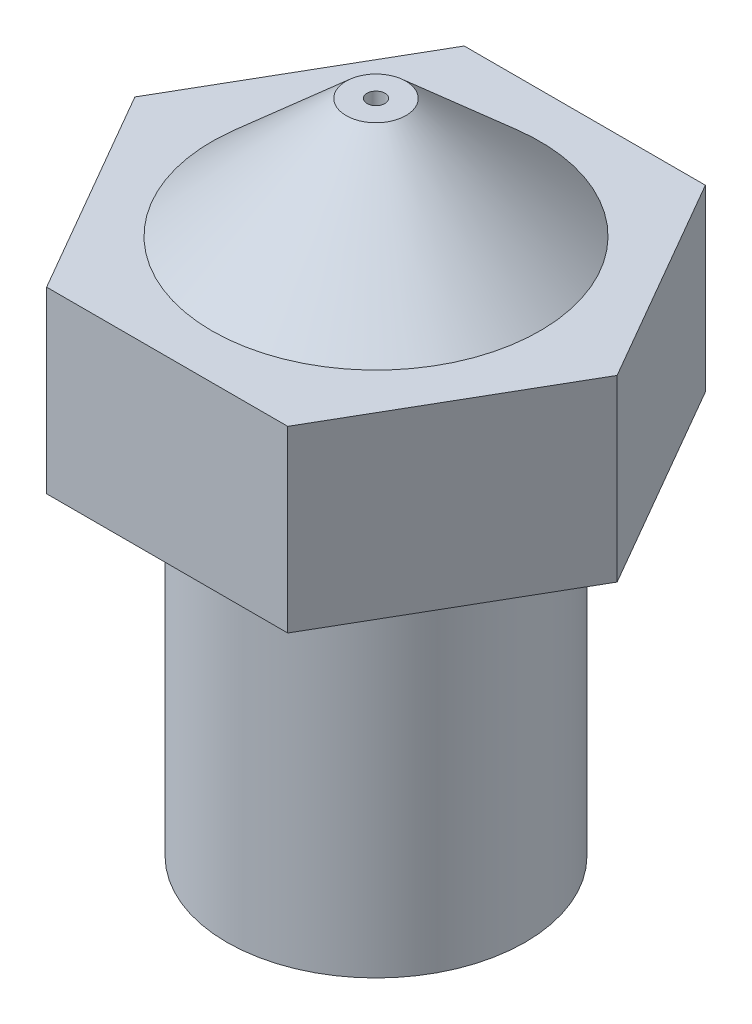
from build123d import *

# Parameters (mm, degrees)
BOSS_EXTRUDE1_DEPTH = 3
SKETCH2_R           = 2.75
BOSS_EXTRUDE2_DEPTH = 2
BOSS_EXTRUDE2_TAPER = 48.36
SKETCH4_R           = 0.15
CUT_EXTRUDE1_DEPTH  = 1.5
SKETCH6_R           = 2.5
BOSS_EXTRUDE3_DEPTH = 6
SKETCH7_R           = 1
CUT_EXTRUDE3_DEPTH  = 9.5


with BuildPart() as part:
    # Sketch1 → Boss-Extrude1 (new body)
    with BuildSketch(Plane(origin=(0, 0, 0), x_dir=(1, 0, 0), z_dir=(0, 1, 0))):
        Polygon((4.041451884, 0), (2.020725942, 3.5), (-2.020725942, 3.5), (-4.041451884, 0), (-2.020725942, -3.5), (2.020725942, -3.5), align=None)
    extrude(amount=BOSS_EXTRUDE1_DEPTH)

    # Sketch2 → Boss-Extrude2 (add)
    with BuildSketch(Plane(origin=(0, 3, 0), x_dir=(1, 0, 0), z_dir=(0, 1, 0))):
        Circle(SKETCH2_R)
    extrude(amount=BOSS_EXTRUDE2_DEPTH, taper=BOSS_EXTRUDE2_TAPER)

    # Sketch4 → Cut-Extrude1 (cut)
    with BuildSketch(Plane(origin=(0, 5, 0), x_dir=(1, 0, 0), z_dir=(0, 1, 0))):
        with Locations(Location((0, 0, 0), (0, 0, 270))):
            Circle(SKETCH4_R)
    extrude(amount=-CUT_EXTRUDE1_DEPTH, mode=Mode.SUBTRACT)

    # Sketch6 → Boss-Extrude3 (add)
    with BuildSketch(Plane.XZ):
        with Locations(Location((0, 0, 0), (0, 0, 270))):
            Circle(SKETCH6_R)
    extrude(amount=BOSS_EXTRUDE3_DEPTH)

    # Sketch7 → Cut-Extrude3 (cut)
    with BuildSketch(Plane.XZ.offset(6)):
        with Locations(Location((0, 0, 0), (0, 0, 270))):
            Circle(SKETCH7_R)
    extrude(amount=-CUT_EXTRUDE3_DEPTH, mode=Mode.SUBTRACT)


solid = part.part
